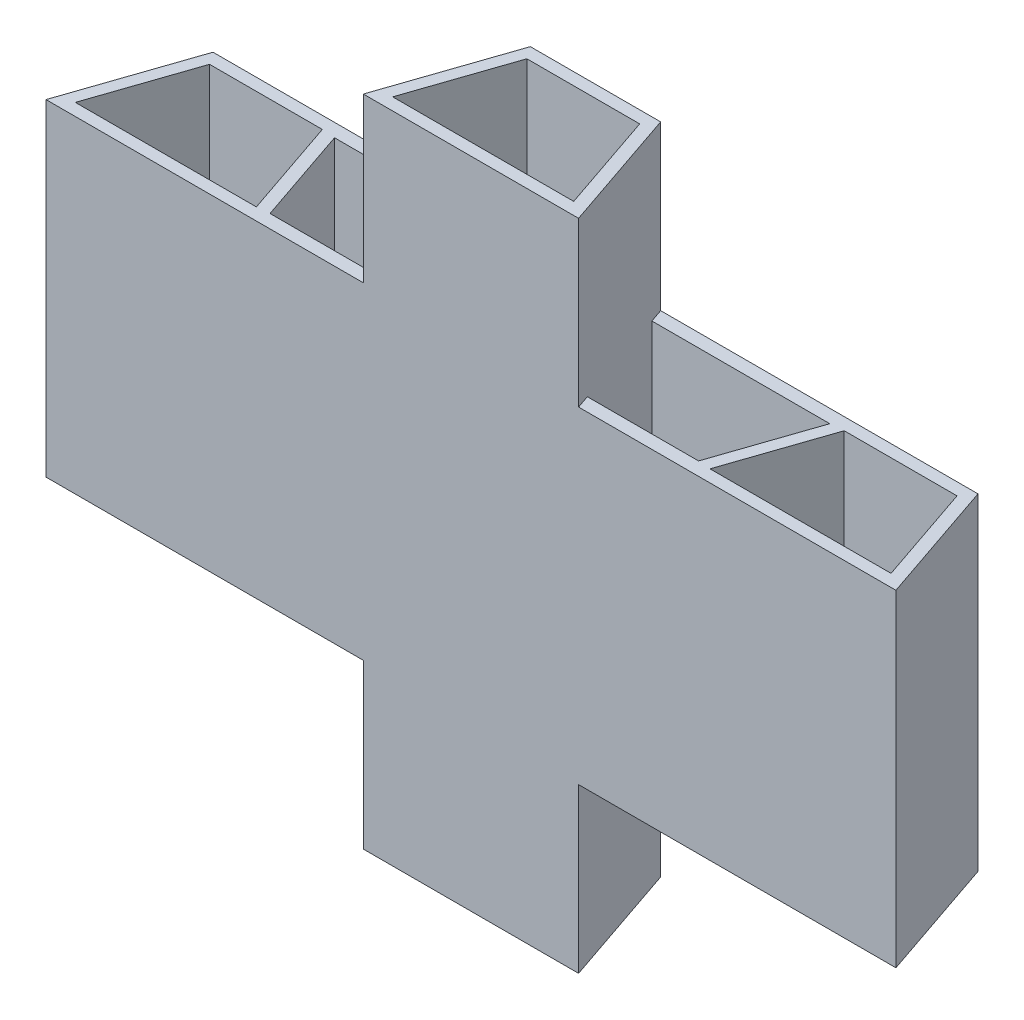
from build123d import *

# Parameters (mm, degrees)
BOSS_EXTRUDE1_DEPTH = 73.5
BOSS_EXTRUDE2_DEPTH = 36.75


with BuildPart() as part:
    # Sketch2 → Boss-Extrude1 (new, symmetric)
    with BuildSketch(Plane(origin=(0, 0, 0), x_dir=(1, 0, 0), z_dir=(0, 1, 0))):
        Polygon((24.192265263, 0), (14.646810718, 28), (-14.646810718, 28), (-24.192265263, 0), align=None)
        Polygon((12.678900893, 25.25), (-12.678900893, 25.25), (-20.349355439, 2.75), (20.349355439, 2.75), align=None, mode=Mode.SUBTRACT)
    extrude(amount=BOSS_EXTRUDE1_DEPTH, both=True)

    # Sketch3 → Boss-Extrude2 (add, symmetric)
    # profile 1 of 2: a face of its own
    with BuildSketch(Plane(origin=(0, 0, 0), x_dir=(1, 0, 0), z_dir=(0, 1, 0))):
        Polygon((-23.169537991, 3), (-48.169537991, 3), (-55.669537991, 25), (-15.669537991, 25), (-14.646810718, 28), (-85.985886699, 28), (-95.531341245, 0), (-24.192265263, 0), align=None)
        Polygon((-58.660175088, 25.25), (-50.989720543, 2.75), (-91.68843142, 2.75), (-84.017976875, 25.25), align=None, mode=Mode.SUBTRACT)
    # profile 2 of 2: a face of its own
    with BuildSketch(Plane(origin=(0, 0, 0), x_dir=(1, 0, 0), z_dir=(0, 1, 0))):
        Polygon((24.192265263, 0), (23.169537991, 3), (48.169537991, 3), (55.669537991, 25), (15.669537991, 25), (14.646810718, 28), (85.985886699, 28), (95.531341245, 0), align=None)
        Polygon((84.017976875, 25.25), (58.660175088, 25.25), (50.989720543, 2.75), (91.68843142, 2.75), align=None, mode=Mode.SUBTRACT)
    extrude(amount=BOSS_EXTRUDE2_DEPTH, both=True)


solid = part.part
